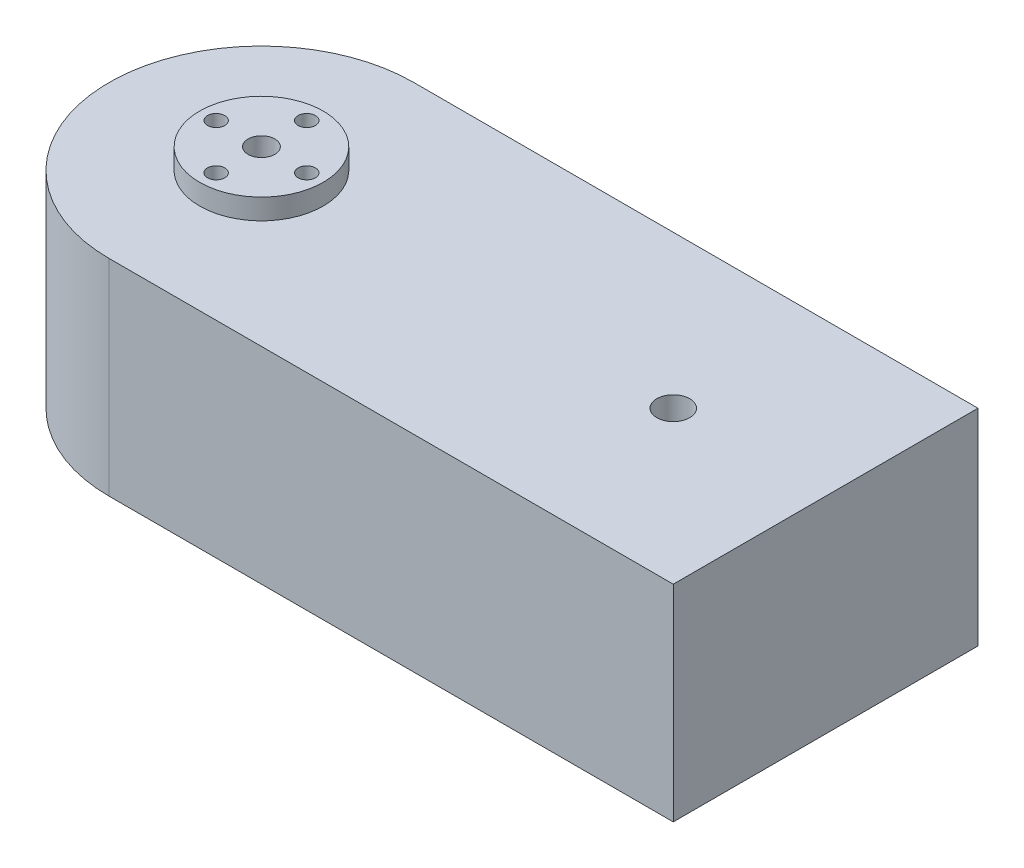
from build123d import *

# Parameters (mm, degrees)
BOSS_EXTRUDE3_DEPTH  = 10
SKETCH4_R            = 15
BOSS_EXTRUDE4_DEPTH  = 5
BOSS_EXTRUDE5_START  = 40
BOSS_EXTRUDE5_DEPTH  = 40
SKETCH8_R            = 6.1
BOSS_EXTRUDE10_DEPTH = 10
BOSS_EXTRUDE12_DEPTH = 25.25
BOSS_EXTRUDE13_DEPTH = 18.25
SKETCH13_W           = 49.5
SKETCH13_H           = 5
BOSS_EXTRUDE14_DEPTH = 18.25
SKETCH5_R            = 2.1
SKETCH5_R_2          = 3.25
SKETCH5_R_3          = 4
CUT_EXTRUDE5_DEPTH   = 18.25
SKETCH14_R           = 5.2
BOSS_EXTRUDE15_DEPTH = 10


with BuildPart() as part:
    # Sketch1 → Boss-Extrude3 (new body)
    with BuildSketch(Plane(origin=(0, 0, 0), x_dir=(1, 0, 0), z_dir=(0, 1, 0))):
        with BuildLine():
            Line((0, 37), (100, 37))
            Line((100, 37), (136.997861734, 37))
            Line((136.997861734, 37), (136.997861734, -37))
            Line((136.997861734, -37), (100, -37))
            Line((100, -37), (0, -37))
            ThreePointArc((0, -37), (-37, 0), (0, 37))
        make_face()
    extrude(amount=BOSS_EXTRUDE3_DEPTH)

    # Sketch4 → Boss-Extrude4 (add)
    with BuildSketch(Plane(origin=(0, 10, 0), x_dir=(1, 0, 0), z_dir=(0, 1, 0))):
        with Locations(Location((0, 0, 0), (0, 0, 270))):
            Circle(SKETCH4_R)
    extrude(amount=BOSS_EXTRUDE4_DEPTH)

    # Sketch7 → Boss-Extrude5 (add)
    with BuildSketch(Plane.XZ.offset(BOSS_EXTRUDE5_START)):
        with BuildLine():
            Line((0, -37), (136.997861734, -37))
            Line((136.997861734, -37), (136.997861734, 37))
            Line((136.997861734, 37), (0, 37))
            ThreePointArc((0, 37), (-37, 0), (0, -37))
        make_face()
        with BuildLine():
            ThreePointArc((0, 33), (-33, 0), (0, -33))
            Line((0, -33), (133, -33))
            Line((133, -33), (133, 33))
            Line((133, 33), (0, 33))
        make_face(mode=Mode.SUBTRACT)
    extrude(amount=-BOSS_EXTRUDE5_DEPTH)

    # Sketch8 → Boss-Extrude10 (add)
    # profile 1 of 2: a face of its own
    with BuildSketch(Plane.XZ):
        Polygon((83.5, 33), (83.5, 24), (83.5, 14.75), (100, 14.75), (116.5, 14.75), (116.5, 33), align=None)
        with Locations(Location((100, 24, 0), (0, 0, 270))):
            Circle(SKETCH8_R, mode=Mode.SUBTRACT)
    # profile 2 of 2: a face of its own
    with BuildSketch(Plane.XZ):
        Polygon((83.5, -14.75), (83.5, -30.5), (83.5, -33), (116.5, -33), (116.5, -30.5), (116.5, -14.75), (100, -14.75), align=None)
        with Locations(Location((100, -24, 0), (0, 0, 270))):
            Circle(SKETCH8_R, mode=Mode.SUBTRACT)
    extrude(amount=BOSS_EXTRUDE10_DEPTH)

    # Sketch12 → Boss-Extrude12 (add)
    with BuildSketch(Plane.XZ.offset(10)):
        Polygon((90, 14.75), (90, 24), (90, 33), (83.5, 33), (83.5, 14.75), align=None)
        Polygon((116.5, 33), (110, 33), (110, 24), (110, 14.75), (116.5, 14.75), align=None)
        Polygon((110, -14.75), (110, -24), (110, -33), (116.5, -33), (116.5, -14.75), align=None)
        Polygon((90, -24), (90, -14.75), (83.5, -14.75), (83.5, -33), (90, -33), align=None)
    extrude(amount=BOSS_EXTRUDE12_DEPTH)

    # Sketch9 → Boss-Extrude13 (add)
    with BuildSketch(Plane(origin=(0, 0, 33), x_dir=(-1, 0, 0), z_dir=(0, 0, -1))):
        Polygon((-133, -35), (-133, -40), (-83.5, -40), (-83.5, -35.25), (-90, -35.25), (-90, -35), (-110, -35), (-110, -35.25), (-116.5, -35.25), (-116.5, -35), align=None)
    extrude(amount=BOSS_EXTRUDE13_DEPTH)

    # Sketch13 → Boss-Extrude14 (add)
    with BuildSketch(Plane.XY.offset(-33)):
        with Locations((108.25, -37.5)):
            Rectangle(SKETCH13_W, SKETCH13_H)
    extrude(amount=BOSS_EXTRUDE14_DEPTH)

    # Sketch5 → Cut-Extrude5 (cut)
    with BuildSketch(Plane.XZ):
        with Locations(Location((-11, 0, 0), (0, 0, 270))):
            Circle(SKETCH5_R)
        with Locations(Location((0, 0, 0), (0, 0, 270))):
            Circle(SKETCH5_R_2)
        with Locations(Location((0, 11, 0), (0, 0, 270))):
            Circle(SKETCH5_R)
        with Locations(Location((11, 0, 0), (0, 0, 270))):
            Circle(SKETCH5_R)
        with Locations(Location((0, -11, 0), (0, 0, 270))):
            Circle(SKETCH5_R)
        with Locations(Location((100, 0, 0), (0, 0, 270))):
            Circle(SKETCH5_R_3)
    extrude(amount=-CUT_EXTRUDE5_DEPTH, mode=Mode.SUBTRACT)

    # Sketch14 → Boss-Extrude15 (add)
    with BuildSketch(Plane.XZ):
        with Locations(Location((100, 24, 0), (0, 0, 90))):
            Circle(SKETCH14_R)
        with Locations(Location((100, -24, 0), (0, 0, 90))):
            Circle(SKETCH14_R)
    extrude(amount=BOSS_EXTRUDE15_DEPTH)


solid = part.part
